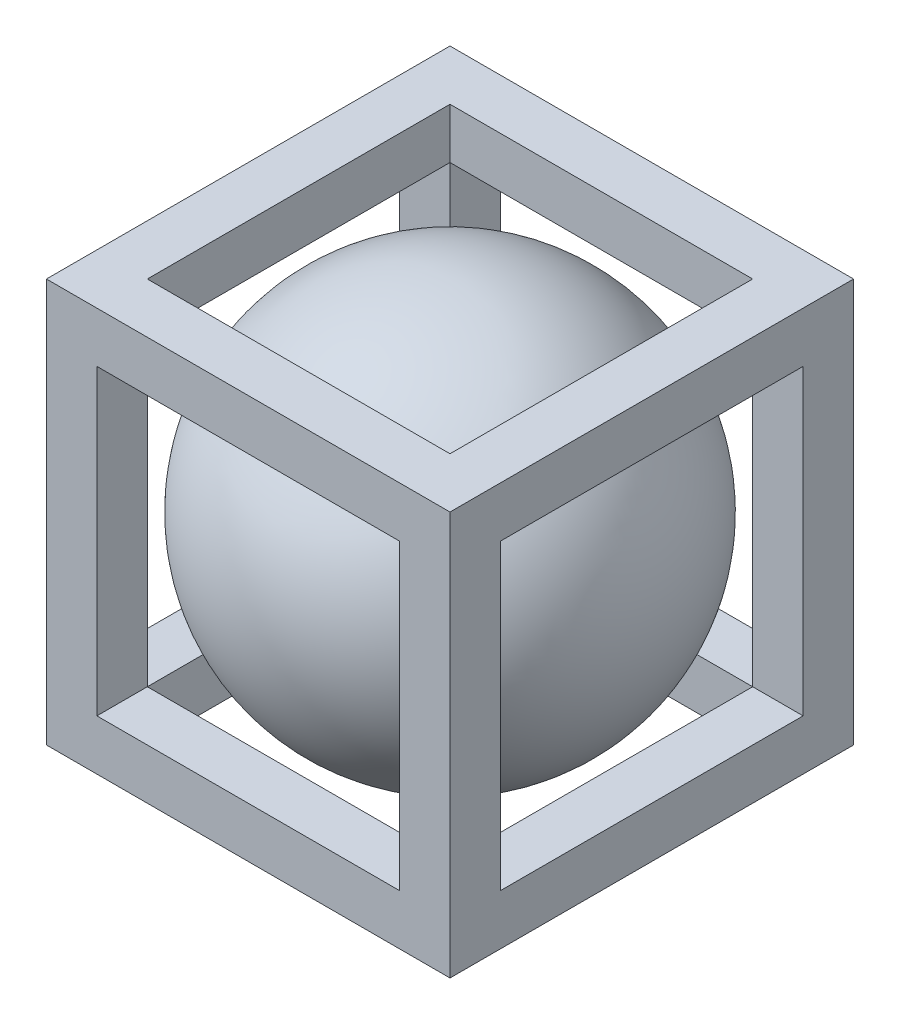
from build123d import *

# Parameters (mm, degrees)
BOSS_EXTRUDE1_DEPTH      = 20
BOSS_EXTRUDE1_DEPTH_BACK = 20
SKETCH1_W                = 40
SKETCH1_H                = 40
CUT_EXTRUDE1_DEPTH       = 35.641016151
CUT_EXTRUDE1_DEPTH_BACK  = 35.641016151
SKETCH2_W                = 30
SKETCH2_H                = 30
CUT_EXTRUDE2_DEPTH       = 35.641016151
CUT_EXTRUDE2_DEPTH_BACK  = 35.641016151
SKETCH3_W                = 30
SKETCH3_H                = 30
CUT_EXTRUDE3_DEPTH       = 35.641016151
CUT_EXTRUDE3_DEPTH_BACK  = 35.641016151
SKETCH4_W                = 30
SKETCH4_H                = 30


with BuildPart() as part:
    # Sketch1 → Boss-Extrude1 (new, two sides: drawn at the far end of the back side and taken through both)
    with BuildSketch(Plane.XY.offset(-BOSS_EXTRUDE1_DEPTH_BACK)):
        Rectangle(SKETCH1_W, SKETCH1_H)
    extrude(amount=BOSS_EXTRUDE1_DEPTH + BOSS_EXTRUDE1_DEPTH_BACK)

    # Sketch2 → Cut-Extrude1 (cut, two sides: drawn at the far end of the back side and taken through both)
    with BuildSketch(Plane.XY.offset(-CUT_EXTRUDE1_DEPTH_BACK)):
        Rectangle(SKETCH2_W, SKETCH2_H)
    extrude(amount=CUT_EXTRUDE1_DEPTH + CUT_EXTRUDE1_DEPTH_BACK, mode=Mode.SUBTRACT)

    # Sketch3 → Cut-Extrude2 (cut, two sides: drawn at the far end of the back side and taken through both)
    with BuildSketch(Plane(origin=(0, 0, 0), x_dir=(1, 0, 0), z_dir=(0, 1, 0)).offset(-CUT_EXTRUDE2_DEPTH_BACK)):
        Rectangle(SKETCH3_W, SKETCH3_H)
    extrude(amount=CUT_EXTRUDE2_DEPTH + CUT_EXTRUDE2_DEPTH_BACK, mode=Mode.SUBTRACT)

    # Sketch4 → Cut-Extrude3 (cut, two sides: drawn at the far end of the back side and taken through both)
    with BuildSketch(Plane(origin=(0, 0, 0), x_dir=(0, 0, -1), z_dir=(1, 0, 0)).offset(-CUT_EXTRUDE3_DEPTH_BACK)):
        Rectangle(SKETCH4_W, SKETCH4_H)
    extrude(amount=CUT_EXTRUDE3_DEPTH + CUT_EXTRUDE3_DEPTH_BACK, mode=Mode.SUBTRACT)


with BuildPart() as body_2:
    # Sketch5 → Revolve1 (revolve)
    with BuildSketch(Plane.XY):
        with BuildLine():
            Line((-20, 0), (20, 0))
            ThreePointArc((20, 0), (0, 20), (-20, 0))
        make_face()
    revolve(axis=Axis((-20, 0, 0), (1, 0, 0)))


solid = Compound([part.part, body_2.part])
